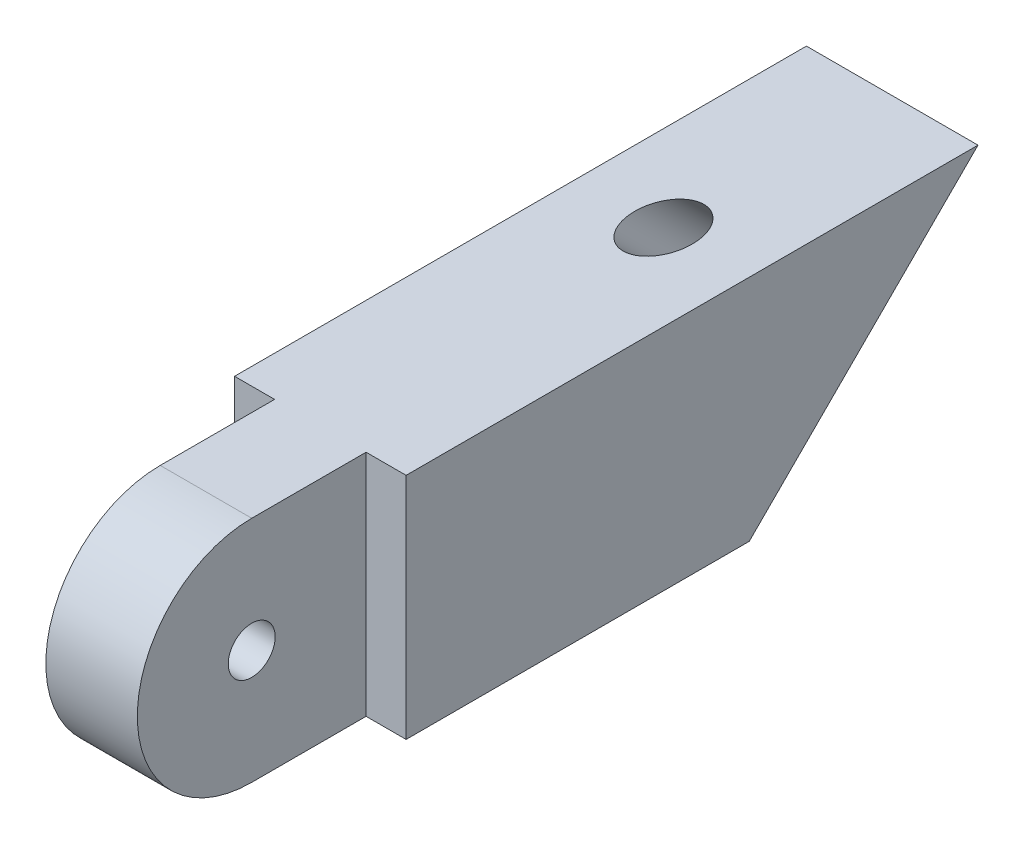
from build123d import *

# Parameters (mm, degrees)
SKETCH6_W           = 140
SKETCH6_H           = 40
BOSS_EXTRUDE2_DEPTH = 30
SKETCH9_W           = 7
SKETCH9_H           = 40
CUT_EXTRUDE3_DEPTH  = 40
CUT_EXTRUDE6_DEPTH  = 45
CUT_EXTRUDE7_DEPTH  = 45
SKETCH22_R          = 4.1
CUT_EXTRUDE8_DEPTH  = 45
CUT_EXTRUDE9_DEPTH  = 45
SKETCH26_R          = 10
CUT_EXTRUDE10_DEPTH = 10
SKETCH28_R          = 5
CUT_EXTRUDE11_DEPTH = 35


with BuildPart() as part:
    # Sketch6 → Boss-Extrude2 (new body)
    with BuildSketch(Plane(origin=(0, 0, 0), x_dir=(0, 0, -1), z_dir=(1, 0, 0))):
        Rectangle(SKETCH6_W, SKETCH6_H)
    extrude(amount=BOSS_EXTRUDE2_DEPTH)

    # Sketch9 → Cut-Extrude3 (cut)
    with BuildSketch(Plane.XY.offset(70)):
        with Locations((3.5, 0)):
            Rectangle(SKETCH9_W, SKETCH9_H)
        with Locations((26.5, 0)):
            Rectangle(SKETCH9_W, SKETCH9_H)
    extrude(amount=-CUT_EXTRUDE3_DEPTH, mode=Mode.SUBTRACT)

    # Sketch18 → Cut-Extrude6 (cut)
    with BuildSketch(Plane(origin=(23, 0, 0), x_dir=(0, 0, -1), z_dir=(1, 0, 0))):
        with BuildLine():
            Line((-70, 20), (-70, 0))
            ThreePointArc((-70, 0), (-64.142135624, 14.142135624), (-50, 20))
            Line((-50, 20), (-70, 20))
        make_face()
    extrude(amount=-CUT_EXTRUDE6_DEPTH, mode=Mode.SUBTRACT)

    # Sketch19 → Cut-Extrude7 (cut)
    with BuildSketch(Plane(origin=(23, 0, 0), x_dir=(0, 0, -1), z_dir=(1, 0, 0))):
        with BuildLine():
            Line((-70, 0), (-70, -20))
            Line((-70, -20), (-50, -20))
            ThreePointArc((-50, -20), (-64.142135624, -14.142135624), (-70, 0))
        make_face()
    extrude(amount=-CUT_EXTRUDE7_DEPTH, mode=Mode.SUBTRACT)

    # Sketch22 → Cut-Extrude8 (cut)
    with BuildSketch(Plane(origin=(23, 0, 0), x_dir=(0, 0, -1), z_dir=(1, 0, 0))):
        with Locations(Location((-50, 0, 0), (0, 0, 90))):
            Circle(SKETCH22_R)
    extrude(amount=-CUT_EXTRUDE8_DEPTH, mode=Mode.SUBTRACT)

    # Sketch24 → Cut-Extrude9 (cut)
    with BuildSketch(Plane(origin=(30, 0, 0), x_dir=(0, 0, -1), z_dir=(1, 0, 0))):
        Polygon((70, 20), (30, -20), (70, -20), align=None)
    extrude(amount=-CUT_EXTRUDE9_DEPTH, mode=Mode.SUBTRACT)

    # Sketch26 → Cut-Extrude10 (cut)
    with BuildSketch(Plane(origin=(0, -25, -25), x_dir=(1, 0, 0), z_dir=(0, -0.707106781186551, -0.7071067811865441))):
        with Locations(Location((15, -35.355339059, 0), (0, 0, 270))):
            Circle(SKETCH26_R)
    extrude(amount=-CUT_EXTRUDE10_DEPTH, mode=Mode.SUBTRACT)

    # Sketch28 → Cut-Extrude11 (cut)
    with BuildSketch(Plane(origin=(0, -17.928932188, -17.928932188), x_dir=(1, 0, 0), z_dir=(0, -0.7071067811865509, -0.7071067811865442))):
        with Locations(Location((15, -35.355339059, 0), (0, 0, 270))):
            Circle(SKETCH28_R)
    extrude(amount=-CUT_EXTRUDE11_DEPTH, mode=Mode.SUBTRACT)


solid = part.part
